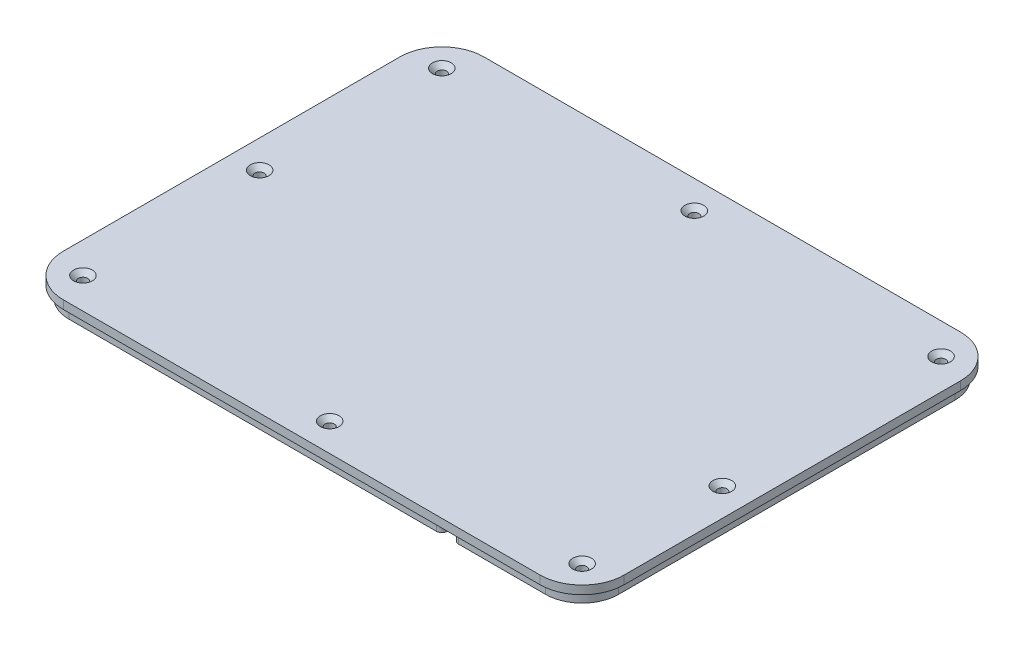
from build123d import *

# Parameters (mm, degrees)
BASE_PLATE_DEPTH         = 3
INNER_START              = -3
INNER_BASE_PROFILE_DEPTH = 4
MOUNTING_START           = -7
BASEPLATE_5_R            = 1.65
MOUNTING_HOLES_DEPTH     = 7
COUNTERSINK_SIZE         = 1.7


with BuildPart() as part:
    # BasePlate → Base Plate (new body)
    with BuildSketch(Plane(origin=(0, 0, 0), x_dir=(1, 0, 0), z_dir=(0, 1, 0))):
        with BuildLine():
            Line((-85, 75), (85, 75))
            ThreePointArc((85, 75), (95.606601718, 70.606601718), (100, 60))
            Line((100, 60), (100, -60))
            ThreePointArc((100, -60), (95.606601718, -70.606601718), (85, -75))
            Line((85, -75), (-85, -75))
            ThreePointArc((-85, -75), (-95.606601718, -70.606601718), (-100, -60))
            Line((-100, -60), (-100, 60))
            ThreePointArc((-100, 60), (-95.606601718, 70.606601718), (-85, 75))
        make_face()
    extrude(amount=-BASE_PLATE_DEPTH)

    # BasePlate<4> → Inner Base Profile (add)
    with BuildSketch(Plane(origin=(0, 0, 0), x_dir=(1, 0, 0), z_dir=(0, 1, 0)).offset(INNER_START)):
        with BuildLine():
            Line((-85, 73), (46, 73))
            ThreePointArc((46, 73), (47.414213562, 72.414213562), (48, 71))
            ThreePointArc((48, 71), (50, 69), (52, 71))
            ThreePointArc((52, 71), (52.585786438, 72.414213562), (54, 73))
            Line((54, 73), (85, 73))
            ThreePointArc((85, 73), (94.192388155, 69.192388155), (98, 60))
            Line((98, 60), (98, -60))
            ThreePointArc((98, -60), (94.192388155, -69.192388155), (85, -73))
            Line((85, -73), (54, -73))
            ThreePointArc((54, -73), (52.585786438, -72.414213562), (52, -71))
            ThreePointArc((52, -71), (50, -69), (48, -71))
            ThreePointArc((48, -71), (47.414213562, -72.414213562), (46, -73))
            Line((46, -73), (-85, -73))
            ThreePointArc((-85, -73), (-94.192388155, -69.192388155), (-98, -60))
            Line((-98, -60), (-98, 60))
            ThreePointArc((-98, 60), (-94.192388155, 69.192388155), (-85, 73))
        make_face()
    extrude(amount=-INNER_BASE_PROFILE_DEPTH)

    # BasePlate<5> → Mounting Holes (cut)
    with BuildSketch(Plane(origin=(0, 0, 0), x_dir=(1, 0, 0), z_dir=(0, 1, 0)).offset(MOUNTING_START)):
        with Locations(Location((90, -15, 0), (0, 0, 270))):
            Circle(BASEPLATE_5_R)
        with Locations(Location((-89, 64, 0), (0, 0, 270))):
            Circle(BASEPLATE_5_R)
        with Locations(Location((89, 64, 0), (0, 0, 270))):
            Circle(BASEPLATE_5_R)
        with Locations(Location((89, -64, 0), (0, 0, 270))):
            Circle(BASEPLATE_5_R)
        with Locations(Location((-89, -64, 0), (0, 0, 270))):
            Circle(BASEPLATE_5_R)
        with Locations(Location((0, 65, 0), (0, 0, 270))):
            Circle(BASEPLATE_5_R)
        with Locations(Location((-90, 0, 0), (0, 0, 270))):
            Circle(BASEPLATE_5_R)
        with Locations(Location((0, -65, 0), (0, 0, 270))):
            Circle(BASEPLATE_5_R)
    extrude(amount=MOUNTING_HOLES_DEPTH, mode=Mode.SUBTRACT)

    # Countersink
    countersink_edges = [part.edges().sort_by_distance(p)[0] for p in [
        (-89, 0, 62.35),
        (0, 0, -66.65),
        (89, 0, -65.65),
        (90, 0, 13.35),
        (89, 0, 62.35),
        (-90, 0, -1.65),
        (-89, 0, -65.65),
        (0, 0, 63.35),
    ]]
    chamfer(countersink_edges, length=COUNTERSINK_SIZE)


solid = part.part
